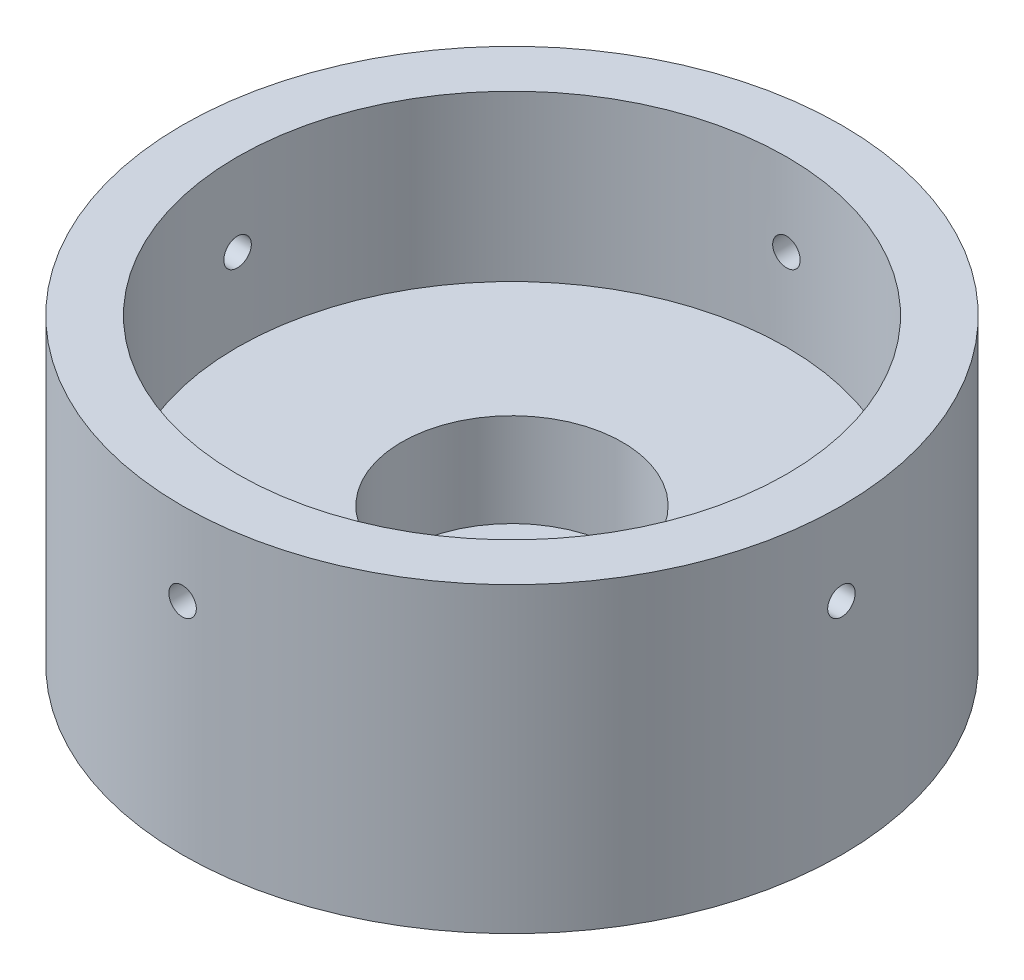
from build123d import *

# Parameters (mm, degrees)
SKETCH1_R           = 60
BOSS_EXTRUDE1_DEPTH = 35
SKETCH2_R           = 20.1
CUT_EXTRUDE1_DEPTH  = 17
SKETCH3_R           = 3
CUT_EXTRUDE2_DEPTH  = 10
SKETCH5_R           = 50
CUT_EXTRUDE3_DEPTH  = 10
MOVE_FACE1_BY       = 20
MOVE_FACE4_BY       = 10
SKETCH6_R           = 2.5
CUT_EXTRUDE4_DEPTH  = 102.118742081
CIRPATTERN1_COUNT   = 2
CIRPATTERN1_ANGLE   = 90


with BuildPart() as part:
    # Sketch1 → Boss-Extrude1 (new body)
    with BuildSketch(Plane(origin=(0, 0, 0), x_dir=(1, 0, 0), z_dir=(0, 1, 0))):
        with Locations(Location((0, 0, 0), (0, 0, 270))):
            Circle(SKETCH1_R)
    extrude(amount=BOSS_EXTRUDE1_DEPTH)

    # Sketch2 → Cut-Extrude1 (cut)
    with BuildSketch(Plane(origin=(0, 35, 0), x_dir=(1, 0, 0), z_dir=(0, 1, 0))):
        with Locations(Location((0, 0, 0), (0, 0, 270))):
            Circle(SKETCH2_R)
    extrude(amount=-CUT_EXTRUDE1_DEPTH, mode=Mode.SUBTRACT)

    # Sketch3 → Cut-Extrude2 (cut)
    with BuildSketch(Plane.XZ):
        with Locations(Location((-30, 30, 0), (0, 0, 270))):
            Circle(SKETCH3_R)
        with Locations(Location((30, 30, 0), (0, 0, 270))):
            Circle(SKETCH3_R)
        with Locations(Location((30, -30, 0), (0, 0, 270))):
            Circle(SKETCH3_R)
        with Locations(Location((-30, -30, 0), (0, 0, 270))):
            Circle(SKETCH3_R)
    extrude(amount=-CUT_EXTRUDE2_DEPTH, mode=Mode.SUBTRACT)

    # Sketch5 → Cut-Extrude3 (cut)
    with BuildSketch(Plane(origin=(0, 35, 0), x_dir=(1, 0, 0), z_dir=(0, 1, 0))):
        with Locations(Location((0, 0, 0), (0, 0, 270))):
            Circle(SKETCH5_R)
    extrude(amount=-CUT_EXTRUDE3_DEPTH, mode=Mode.SUBTRACT)

    # Move Face1: a face moved outward by 20.0
    extrude(part.faces().sort_by_distance((-30, 35, 48))[0], amount=MOVE_FACE1_BY, dir=(0, 1, 0))

    # Move Face4: a face moved inward by 10.0
    extrude(part.faces().sort_by_distance((0, 18, 0))[0], amount=MOVE_FACE4_BY, dir=(0, -1, 0), mode=Mode.SUBTRACT)

    # Sketch6 → Cut-Extrude4 (cut, symmetric)
    with BuildSketch(Plane(origin=(0, 0, 0), x_dir=(0, 0, -1), z_dir=(1, 0, 0))):
        with Locations((0, 40)):
            Circle(SKETCH6_R)
    cut_extrude4 = extrude(amount=CUT_EXTRUDE4_DEPTH, both=True, mode=Mode.SUBTRACT)

    # CirPattern1: Cut-Extrude4 ×2 about axis
    cirpattern1_axis = Axis((0, 35, 0), (0, -1, 0))
    for i in range(1, CIRPATTERN1_COUNT):
        add(cut_extrude4.rotate(cirpattern1_axis, i * CIRPATTERN1_ANGLE / (CIRPATTERN1_COUNT - 1)), mode=Mode.SUBTRACT)


solid = part.part
